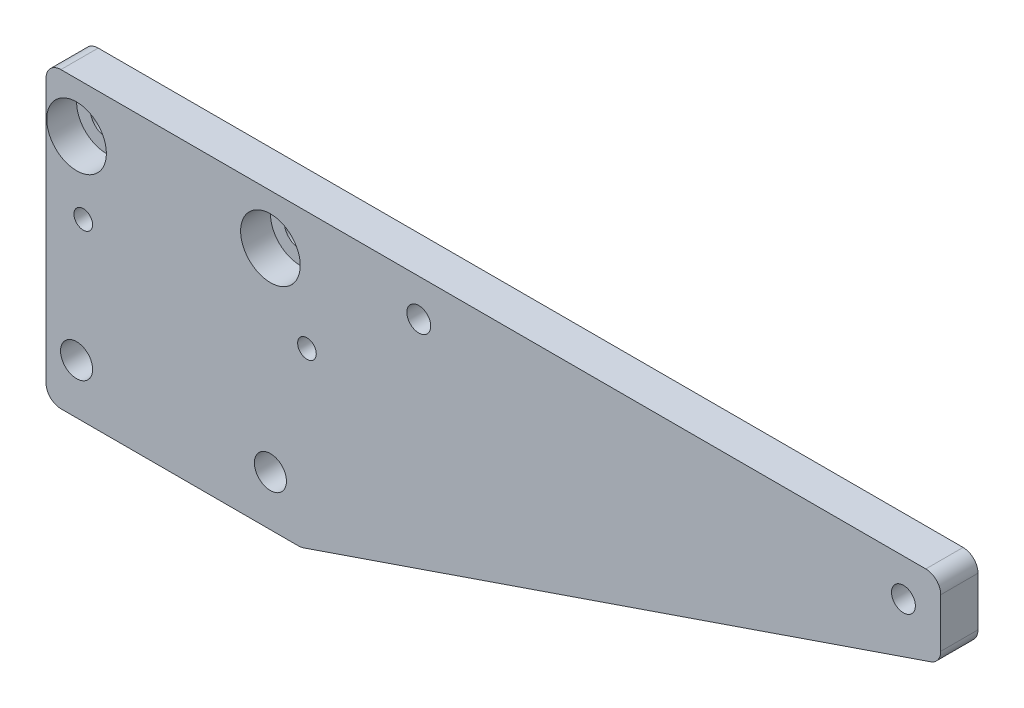
from build123d import *

# Parameters (mm, degrees)
BOSS_EXTRUDE1_DEPTH            = 5
CBORE_FOR_M4_SHCS1_D           = 4.3
CBORE_FOR_M4_SHCS1_CBORE_D     = 8
CBORE_FOR_M4_SHCS1_CBORE_DEPTH = 4
M4_CLEARANCE_HOLE1_D           = 4.3
TAP_DRILL_FOR_M3X0_5_TAP1_D    = 2.5
M3_CLEARANCE_HOLE2_D           = 3.2
FILLET1_R                      = 2


with BuildPart() as part:
    # Sketch1 → Boss-Extrude1 (new body)
    with BuildSketch(Plane.XY):
        Polygon((17.1, 19.7), (102.9, 19.7), (102.9, 9.7), (17.1, -19.7), (-17.1, -19.7), (-17.1, 19.7), align=None)
    extrude(amount=BOSS_EXTRUDE1_DEPTH)

    # CBORE for M4 SHCS1 (through all)
    with Locations(Plane.XY.offset(5)):
        with Locations((13, 13), (-13, 13)):
            CounterBoreHole(CBORE_FOR_M4_SHCS1_D / 2, CBORE_FOR_M4_SHCS1_CBORE_D / 2, CBORE_FOR_M4_SHCS1_CBORE_DEPTH)

    # M4 Clearance Hole1 (through all)
    with Locations(Plane.XY.offset(5)):
        with Locations((-13, -13), (13, -13)):
            Hole(M4_CLEARANCE_HOLE1_D / 2)

    # Tap Drill for M3x0.5 Tap1 (through all)
    with Locations(Plane.XY.offset(5)):
        with Locations((-12.1, 3.8), (17.9, 3.8)):
            Hole(TAP_DRILL_FOR_M3X0_5_TAP1_D / 2)

    # M3 Clearance Hole2 (through all)
    with Locations(Plane(origin=(0, 0, 0), x_dir=(-1, 0, 0), z_dir=(0, 0, -1))):
        with Locations((-97.9, 14.7), (-32.9, 14.7)):
            Hole(M3_CLEARANCE_HOLE2_D / 2)

    # Fillet1
    fillet1_edges = [part.edges().sort_by_distance(p)[0] for p in [
        (-17.1, 19.7, 2.5),
        (102.9, 19.7, 2.5),
        (102.9, 9.7, 2.5),
        (17.1, -19.7, 2.5),
        (-17.1, -19.7, 2.5),
    ]]
    fillet(fillet1_edges, radius=FILLET1_R)


solid = part.part
